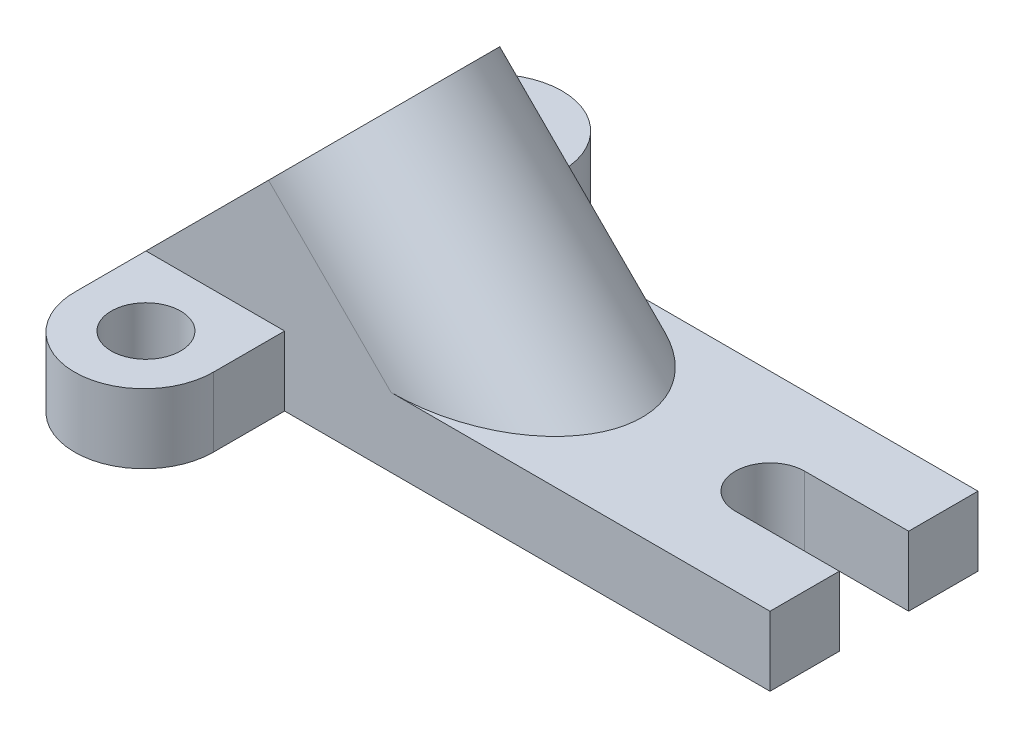
from build123d import *

# Parameters (mm, degrees)
BOSS_EXTRUDE2_DEPTH = 20
SKETCH2_R           = 10
CUT_EXTRUDE1_DEPTH  = 174.204794268
BOSS_EXTRUDE3_REACH = 201.499
CUT_EXTRUDE3_REACH  = 204.653
SKETCH5_R           = 15
CUT_EXTRUDE4_DEPTH  = 182.107428775


with BuildPart() as part:
    # Sketch1 → Boss-Extrude2 (new body)
    with BuildSketch(Plane(origin=(0, 0, 0), x_dir=(1, 0, 0), z_dir=(0, 1, 0))):
        with BuildLine():
            Line((0, 60), (140, 60))
            Line((140, 60), (140, 0))
            Line((140, 0), (0, 0))
            Line((0, 0), (0, -20.563630546))
            ThreePointArc((0, -20.563630546), (-20.285292958, -40.565119434), (-39.999007572, -20.000048944))
            Line((-39.999007572, -20.000048944), (-39.999007572, 80))
            ThreePointArc((-39.999007572, 80), (-19.999503786, 99.999503786), (0, 80))
            Line((0, 80), (0, 60))
        make_face()
    extrude(amount=BOSS_EXTRUDE2_DEPTH)

    # Sketch2 → Cut-Extrude1 (cut, through all)
    with BuildSketch(Plane(origin=(0, 20, 0), x_dir=(1, 0, 0), z_dir=(0, 1, 0))):
        with Locations(Location((-19.999503786, 80, 0), (0, 0, 270))):
            Circle(SKETCH2_R)
        with Locations(Location((-19.999503786, -20.000048944, 0), (0, 0, 270))):
            Circle(SKETCH2_R)
    extrude(amount=-CUT_EXTRUDE1_DEPTH, mode=Mode.SUBTRACT)

    # Boss-Extrude3: up to this face of the body (flat: up to its plane)
    boss_extrude3_end = Plane(part.part.faces().sort_by_distance((37.926780592, 20, -29.884787344))[0])
    # Sketch4 → Boss-Extrude3 (add, up to the picked face)
    with BuildSketch(Plane(origin=(-29.999503786, 29.999503786, 0), x_dir=(0, 0, 1), z_dir=(-0.7071067811865488, 0.7071067811865464, 0)), mode=Mode.PRIVATE) as boss_extrude3_sk1:
        with BuildLine():
            Line((-60, -14.141433871), (-60, 35.858566129))
            ThreePointArc((-60, 35.858566129), (-30, 65.858566129), (0, 35.858566129))
            Line((0, 35.858566129), (0, -14.141433871))
            Line((0, -14.141433871), (-60, -14.141433871))
        make_face()
    boss_extrude3_tool1 = split(extrude(boss_extrude3_sk1.sketch, amount=-BOSS_EXTRUDE3_REACH, mode=Mode.PRIVATE), bisect_by=boss_extrude3_end, keep=Keep.BOTH, mode=Mode.PRIVATE)
    add(boss_extrude3_tool1.solids().sort_by(Axis((-13.775448, 46.22356, -30), (0.7071067811865488, -0.7071067811865464, 0)))[0])

    # Cut-Extrude3: up to this plane
    cut_extrude3_end = Plane(origin=(-20.003474187, 0, 20.563630546), z_dir=(0, 1, 0))
    # Sketch5 → Cut-Extrude3 (cut, up to the surface)
    with BuildSketch(Plane(origin=(-29.999503786, 29.999503786, 0), x_dir=(0, 0, 1), z_dir=(-0.7071067811865487, 0.7071067811865465, 0)), mode=Mode.PRIVATE) as cut_extrude3_sk1:
        with Locations(Location((-30, 35.858566129, 0), (0, 0, 270))):
            Circle(SKETCH5_R)
    cut_extrude3_tool1 = split(extrude(cut_extrude3_sk1.sketch, amount=-CUT_EXTRUDE3_REACH, mode=Mode.PRIVATE), bisect_by=cut_extrude3_end, keep=Keep.BOTH, mode=Mode.PRIVATE)
    add(cut_extrude3_tool1.solids().sort_by_distance((-4.643669, 55.355339, -30))[0], mode=Mode.SUBTRACT)

    # Sketch6 → Cut-Extrude4 (cut, through all)
    with BuildSketch(Plane(origin=(0, 20, 0), x_dir=(1, 0, 0), z_dir=(0, 1, 0))):
        with BuildLine():
            Line((140, 40), (110, 40))
            ThreePointArc((110, 40), (100, 30), (110, 20))
            Line((110, 20), (140, 20))
            Line((140, 20), (140, 40))
        make_face()
    extrude(amount=-CUT_EXTRUDE4_DEPTH, mode=Mode.SUBTRACT)


solid = part.part
